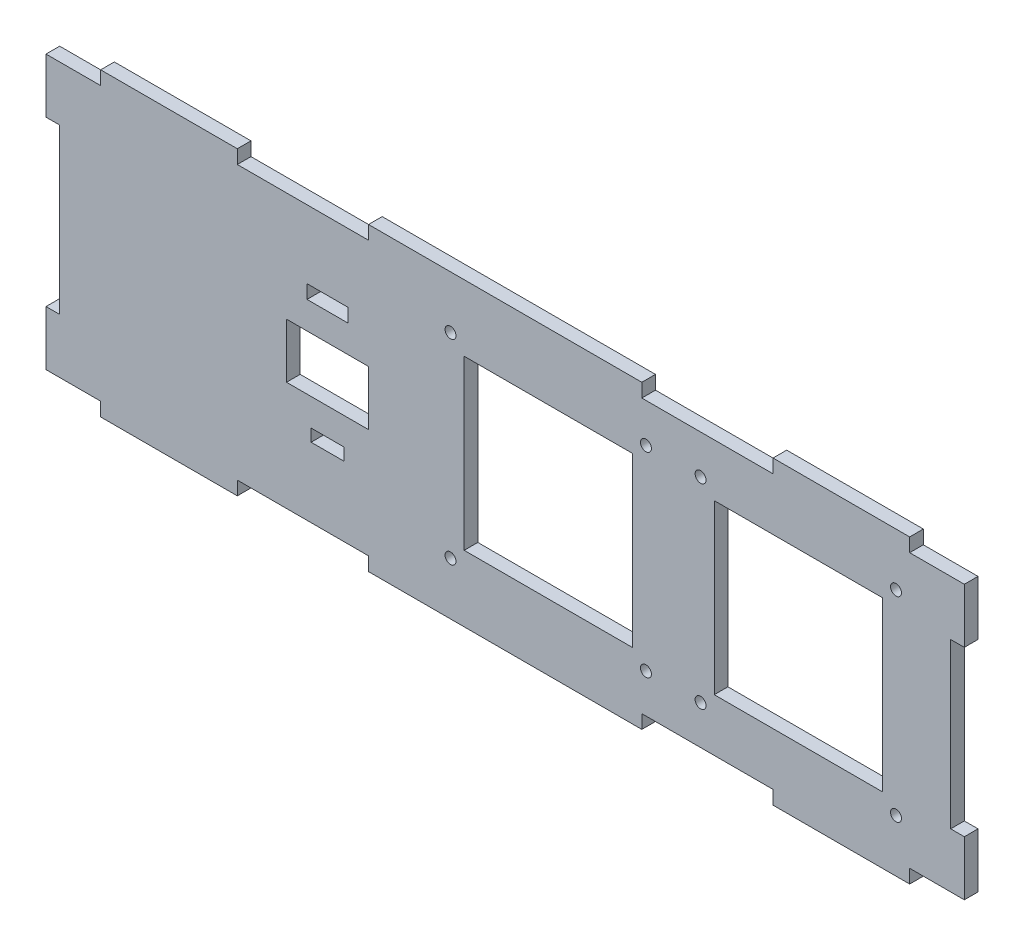
from build123d import *

# Parameters (mm, degrees)
SKETCH1_R           = 2
SKETCH1_W           = 12
SKETCH1_H           = 4.5
SKETCH1_W_2         = 61.5
SKETCH1_H_2         = 61.5
SKETCH1_W_3         = 30
SKETCH1_H_3         = 20
SKETCH1_W_4         = 15
SKETCH1_H_4         = 5
BOSS_EXTRUDE1_DEPTH = 5


with BuildPart() as part:
    # Sketch1 → Boss-Extrude1 (new body)
    with BuildSketch(Plane.XY):
        Polygon((148, -50), (168, -50), (168, -30), (163, -30), (163, 30), (168, 30), (168, 50), (148, 50), (148, 55), (98, 55), (98, 50), (50, 50), (50, 55), (-50, 55), (-50, 50), (-98, 50), (-98, 55), (-148, 55), (-148, 50), (-168, 50), (-168, 30), (-163, 30), (-163, -30), (-168, -30), (-168, -50), (-148, -50), (-148, -55), (-98, -55), (-98, -50), (-50, -50), (-50, -55), (50, -55), (50, -50), (98, -50), (98, -55), (148, -55), align=None)
        with Locations((-20, -35.75)):
            Circle(SKETCH1_R, mode=Mode.SUBTRACT)
        with Locations((-65, -22.25)):
            Rectangle(SKETCH1_W, SKETCH1_H, mode=Mode.SUBTRACT)
        with Locations((51.5, -35.75)):
            Circle(SKETCH1_R, mode=Mode.SUBTRACT)
        with Locations((71.5, -35.75)):
            Circle(SKETCH1_R, mode=Mode.SUBTRACT)
        with Locations((143, -35.75)):
            Circle(SKETCH1_R, mode=Mode.SUBTRACT)
        with Locations((15.75, 0)):
            Rectangle(SKETCH1_W_2, SKETCH1_H_2, mode=Mode.SUBTRACT)
        with Locations((-65, 0)):
            Rectangle(SKETCH1_W_3, SKETCH1_H_3, mode=Mode.SUBTRACT)
        with Locations((-65, 22.5)):
            Rectangle(SKETCH1_W_4, SKETCH1_H_4, mode=Mode.SUBTRACT)
        with Locations((-20, 35.75)):
            Circle(SKETCH1_R, mode=Mode.SUBTRACT)
        with Locations((107.25, 0)):
            Rectangle(SKETCH1_W_2, SKETCH1_H_2, mode=Mode.SUBTRACT)
        with Locations((51.5, 35.75)):
            Circle(SKETCH1_R, mode=Mode.SUBTRACT)
        with Locations((71.5, 35.75)):
            Circle(SKETCH1_R, mode=Mode.SUBTRACT)
        with Locations((143, 35.75)):
            Circle(SKETCH1_R, mode=Mode.SUBTRACT)
    extrude(amount=BOSS_EXTRUDE1_DEPTH)


solid = part.part
